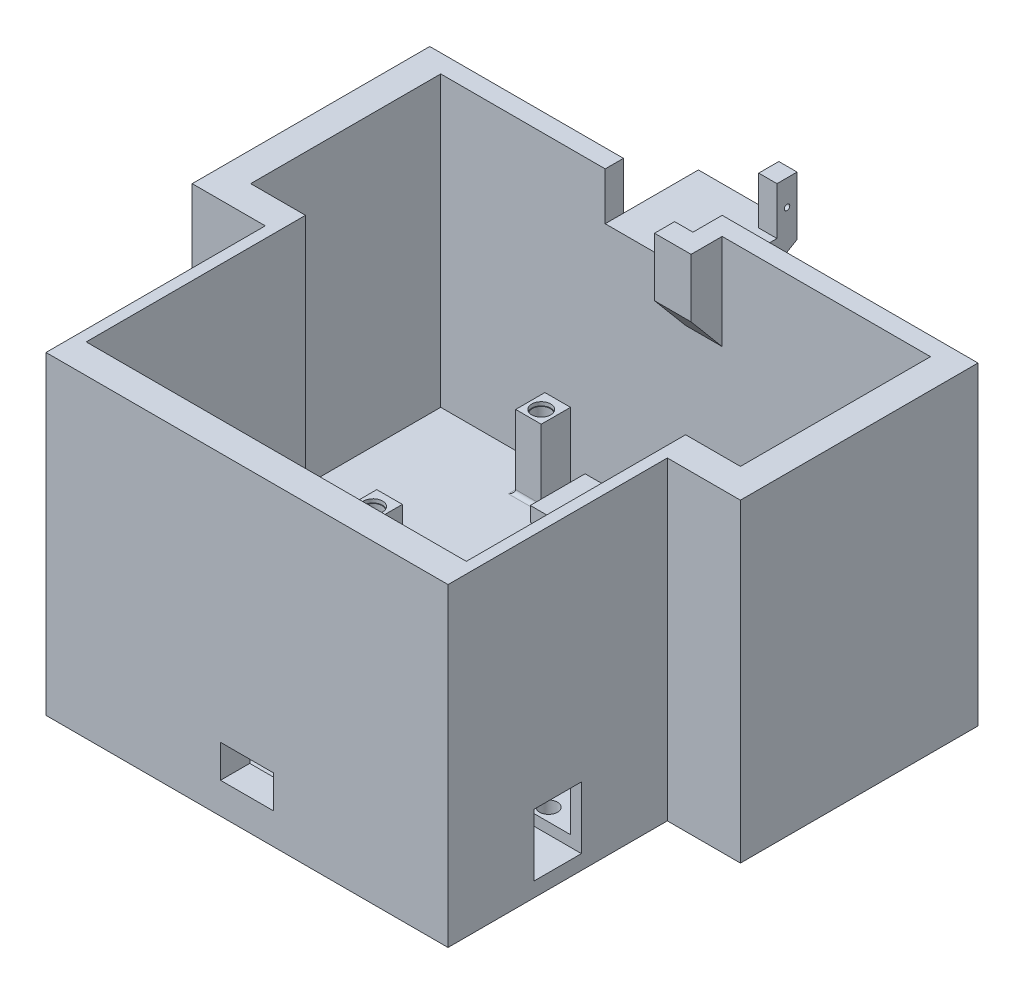
from build123d import *

# Parameters (mm, degrees)
CROQUIS1_W               = 150
CROQUIS1_H               = 150
SALIENTE_EXTRUIR2_DEPTH  = 6
CROQUIS3_W               = 20
CROQUIS3_H               = 60
CORTAR_EXTRUIR2_DEPTH    = 107.235587258
CROQUIS4_W               = 150
CROQUIS4_H               = 25
CORTAR_EXTRUIR3_DEPTH    = 107.235587258
SALIENTE_EXTRUIR3_DEPTH  = 80
CROQUIS6_W               = 16
CROQUIS6_H               = 13
CORTAR_EXTRUIR5_DEPTH    = 80
CROQUIS10_W              = 55
CROQUIS10_H              = 25
CORTAR_EXTRUIR6_DEPTH    = 5
CROQUIS8_W               = 20.5
CROQUIS8_H               = 13
CORTAR_EXTRUIR7_DEPTH    = 2
CROQUIS12_W              = 8
CROQUIS12_H              = 13
CORTAR_EXTRUIR8_DEPTH    = 2
SALIENTE_EXTRUIR6_DEPTH  = 1
CROQUIS17_W              = 8
CROQUIS17_H              = 13
SALIENTE_EXTRUIR7_DEPTH  = 65
CORTAR_EXTRUIR9_REACH    = 171.251
CROQUIS20_W              = 22
CROQUIS20_H              = 13
CROQUIS23_W              = 6
CROQUIS23_H              = 13
CROQUIS23_W_2            = 13
CROQUIS23_H_2            = 6
CORTAR_EXTRUIR10_DEPTH   = 3
CROQUIS24_W              = 22
CROQUIS24_H              = 34
SALIENTE_EXTRUIR9_DEPTH  = 3
SALIENTE_EXTRUIR10_DEPTH = 27
CROQUIS27_W              = 5
CROQUIS27_H              = 5.5
SALIENTE_EXTRUIR14_DEPTH = 13
CORTAR_EXTRUIR11_REACH   = 138.55
CROQUIS30_W              = 45
CROQUIS30_H              = 3
CROQUIS30_W_2            = 62
CROQUIS30_W_3            = 5
CROQUIS30_H_2            = 60
CORTAR_EXTRUIR12_DEPTH   = 27
CROQUIS34_W              = 55
CROQUIS34_H              = 15
SALIENTE_EXTRUIR16_DEPTH = 4
CROQUIS38_W              = 7
CROQUIS38_H              = 8
SALIENTE_EXTRUIR18_DEPTH = 20
CROQUIS39_R              = 2.6
CORTAR_EXTRUIR13_DEPTH   = 1
CROQUIS40_R              = 2.425
CORTAR_EXTRUIR14_DEPTH   = 22
CROQUIS42_R              = 0.75
CORTAR_EXTRUIR15_DEPTH   = 7.5
CROQUIS44_W              = 14.5
CROQUIS44_H              = 9
CORTAR_EXTRUIR17_DEPTH   = 8
REDONDEO2_R              = 1
REDONDEO3_R              = 1
CROQUIS48_R              = 2.6
CORTAR_EXTRUIR19_DEPTH   = 1
CROQUIS49_R              = 2.425
CORTAR_EXTRUIR20_DEPTH   = 131.483715459
CROQUIS50_R              = 2.425
CORTAR_EXTRUIR21_DEPTH   = 133.253544376
CROQUIS51_R              = 2.6
CORTAR_EXTRUIR22_DEPTH   = 1
CROQUIS56_W              = 5
CROQUIS56_H              = 8
CORTAR_EXTRUIR24_DEPTH   = 13
SALIENTE_EXTRUIR20_DEPTH = 5
CROQUIS60_W              = 5
CROQUIS60_H              = 3
SALIENTE_EXTRUIR21_DEPTH = 13
CROQUIS61_W              = 22
CROQUIS61_H              = 8.5
CORTAR_EXTRUIR25_DEPTH   = 15
SALIENTE_EXTRUIR22_DEPTH = 1


with BuildPart() as part:
    # Croquis1 → Saliente-Extruir2 (new body)
    with BuildSketch(Plane(origin=(0, 0, 0), x_dir=(1, 0, 0), z_dir=(0, 1, 0))):
        Rectangle(CROQUIS1_W, CROQUIS1_H)
    extrude(amount=SALIENTE_EXTRUIR2_DEPTH)

    # Croquis3 → Cortar-Extruir2 (cut, through all)
    with BuildSketch(Plane(origin=(0, 6, 0), x_dir=(1, 0, 0), z_dir=(0, 1, 0))):
        with Locations((-65, -45)):
            Rectangle(CROQUIS3_W, CROQUIS3_H)
        with Locations((65, -45)):
            Rectangle(CROQUIS3_W, CROQUIS3_H)
    extrude(amount=-CORTAR_EXTRUIR2_DEPTH, mode=Mode.SUBTRACT)

    # Croquis4 → Cortar-Extruir3 (cut, through all)
    with BuildSketch(Plane(origin=(0, 6, 0), x_dir=(1, 0, 0), z_dir=(0, 1, 0))):
        with Locations((0, 62.5)):
            Rectangle(CROQUIS4_W, CROQUIS4_H)
    extrude(amount=-CORTAR_EXTRUIR3_DEPTH, mode=Mode.SUBTRACT)

    # Croquis5 → Saliente-Extruir3 (add)
    with BuildSketch(Plane(origin=(0, 6, 0), x_dir=(1, 0, 0), z_dir=(0, 1, 0))):
        Polygon((75, -15), (75, 50), (-75, 50), (-75, -15), (-55, -15), (-55, -75), (55, -75), (55, -15), align=None)
        Polygon((67, -7), (67, 42), (-67, 42), (-67, -7), (-47, -7), (-47, -67), (47, -67), (47, -7), align=None, mode=Mode.SUBTRACT)
    extrude(amount=SALIENTE_EXTRUIR3_DEPTH)

    # Croquis6 → Cortar-Extruir5 (cut)
    with BuildSketch(Plane(origin=(0, 86, 0), x_dir=(1, 0, 0), z_dir=(0, 1, 0))):
        with Locations((-55, -45)):
            Rectangle(CROQUIS6_W, CROQUIS6_H)
        with Locations((55, -45)):
            Rectangle(CROQUIS6_W, CROQUIS6_H)
    extrude(amount=-CORTAR_EXTRUIR5_DEPTH, mode=Mode.SUBTRACT)

    # Croquis10 → Cortar-Extruir6 (cut)
    with BuildSketch(Plane.XZ):
        with Locations((0, -37.5)):
            Rectangle(CROQUIS10_W, CROQUIS10_H)
    extrude(amount=-CORTAR_EXTRUIR6_DEPTH, mode=Mode.SUBTRACT)

    # Croquis8 → Cortar-Extruir7 (cut)
    with BuildSketch(Plane(origin=(0, 6, 0), x_dir=(1, 0, 0), z_dir=(0, 1, 0))):
        with Locations((-36.75, -45)):
            Rectangle(CROQUIS8_W, CROQUIS8_H)
        with Locations((36.75, -45)):
            Rectangle(CROQUIS8_W, CROQUIS8_H)
    extrude(amount=-CORTAR_EXTRUIR7_DEPTH, mode=Mode.SUBTRACT)

    # Croquis12 → Cortar-Extruir8 (cut)
    with BuildSketch(Plane(origin=(0, 6, 0), x_dir=(1, 0, 0), z_dir=(0, 1, 0))):
        with Locations((-51, -45)):
            Rectangle(CROQUIS12_W, CROQUIS12_H)
        with Locations((51, -45)):
            Rectangle(CROQUIS12_W, CROQUIS12_H)
    extrude(amount=-CORTAR_EXTRUIR8_DEPTH, mode=Mode.SUBTRACT)

    # Croquis15 → Saliente-Extruir6 (add)
    with BuildSketch(Plane(origin=(0, 6, 0), x_dir=(1, 0, 0), z_dir=(0, 1, 0))):
        Polygon((-47, -7), (-47, -38.5), (-26.5, -38.5), (-26.5, -51.5), (-47, -51.5), (-47, -67), (47, -67), (47, -51.5), (26.5, -51.5), (26.5, -38.5), (47, -38.5), (47, -7), (67, -7), (67, 42), (-67, 42), (-67, -7), align=None)
    extrude(amount=SALIENTE_EXTRUIR6_DEPTH)

    # Croquis17 → Saliente-Extruir7 (add)
    with BuildSketch(Plane(origin=(0, 86, 0), x_dir=(1, 0, 0), z_dir=(0, 1, 0))):
        with Locations((-51, -45)):
            Rectangle(CROQUIS17_W, CROQUIS17_H)
        with Locations((51, -45)):
            Rectangle(CROQUIS17_W, CROQUIS17_H)
    extrude(amount=-SALIENTE_EXTRUIR7_DEPTH)

    # Croquis20 → Cortar-Extruir9 (cut, up to next)
    with BuildSketch(Plane(origin=(0, 0, -50), x_dir=(-1, 0, 0), z_dir=(0, 0, -1)), mode=Mode.PRIVATE) as cortar_extruir9_sk1:
        with Locations((11, 79.5)):
            Rectangle(CROQUIS20_W, CROQUIS20_H)
    cortar_extruir9_tool1 = extrude(cortar_extruir9_sk1.sketch, amount=-CORTAR_EXTRUIR9_REACH, mode=Mode.PRIVATE) & part.part
    add(cortar_extruir9_tool1.solids().sort_by_distance((-11, 79.5, -50))[0], mode=Mode.SUBTRACT)

    # Croquis23 → Cortar-Extruir10 (cut)
    with BuildSketch(Plane(origin=(0, 86, 0), x_dir=(1, 0, 0), z_dir=(0, 1, 0))):
        with Locations((-71, 17.5)):
            Rectangle(CROQUIS23_W, CROQUIS23_H)
        with Locations((71, 17.5)):
            Rectangle(CROQUIS23_W, CROQUIS23_H)
        with Locations((0, -71)):
            Rectangle(CROQUIS23_W_2, CROQUIS23_H_2)
    extrude(amount=-CORTAR_EXTRUIR10_DEPTH, mode=Mode.SUBTRACT)

    # Croquis24 → Saliente-Extruir9 (add)
    with BuildSketch(Plane(origin=(0, 73, 0), x_dir=(1, 0, 0), z_dir=(0, 1, 0))):
        with Locations((-11, 53.5)):
            Rectangle(CROQUIS24_W, CROQUIS24_H)
    extrude(amount=-SALIENTE_EXTRUIR9_DEPTH)

    # Croquis25 → Saliente-Extruir10 (add)
    with BuildSketch(Plane.ZY.offset(22)):
        Polygon((-36.5, 73), (-36.5, 70), (-46.454041192, 58.164319482), (-46.454041192, 73), align=None)
        Polygon((-50, 73), (-70.5, 73), (-70.5, 70), (-50, 58.164319482), align=None)
    extrude(amount=-SALIENTE_EXTRUIR10_DEPTH)

    # Croquis27 → Saliente-Extruir14 (add)
    with BuildSketch(Plane(origin=(0, 73, 0), x_dir=(1, 0, 0), z_dir=(0, 1, 0))):
        with Locations((2.5, 67.75)):
            Rectangle(CROQUIS27_W, CROQUIS27_H)
        with Locations((2.5, 39.25)):
            Rectangle(CROQUIS27_W, CROQUIS27_H)
    extrude(amount=SALIENTE_EXTRUIR14_DEPTH)

    # Cortar-Extruir11: up to this face of the body (flat: up to its plane)
    cortar_extruir11_end = Plane(part.part.faces().sort_by_distance((0, 7, 5.97875439))[0])
    # Croquis30 → Cortar-Extruir11 (cut, up to the picked face)
    with BuildSketch(Plane(origin=(0, 86, 0), x_dir=(1, 0, 0), z_dir=(0, 1, 0)), mode=Mode.PRIVATE) as cortar_extruir11_sk1:
        with Locations((-44.5, 43.5)):
            Rectangle(CROQUIS30_W, CROQUIS30_H)
    cortar_extruir11_tool1 = split(extrude(cortar_extruir11_sk1.sketch, amount=-CORTAR_EXTRUIR11_REACH, mode=Mode.PRIVATE), bisect_by=cortar_extruir11_end, keep=Keep.BOTH, mode=Mode.PRIVATE)
    # Croquis30 → Cortar-Extruir11 (cut, up to the picked face)
    with BuildSketch(Plane(origin=(0, 86, 0), x_dir=(1, 0, 0), z_dir=(0, 1, 0)), mode=Mode.PRIVATE) as cortar_extruir11_sk2:
        with Locations((36, 43.5)):
            Rectangle(CROQUIS30_W_2, CROQUIS30_H)
    cortar_extruir11_tool2 = split(extrude(cortar_extruir11_sk2.sketch, amount=-CORTAR_EXTRUIR11_REACH, mode=Mode.PRIVATE), bisect_by=cortar_extruir11_end, keep=Keep.BOTH, mode=Mode.PRIVATE)
    # Croquis30 → Cortar-Extruir11 (cut, up to the picked face)
    with BuildSketch(Plane(origin=(0, 86, 0), x_dir=(1, 0, 0), z_dir=(0, 1, 0)), mode=Mode.PRIVATE) as cortar_extruir11_sk3:
        with Locations((-49.5, -37)):
            Rectangle(CROQUIS30_W_3, CROQUIS30_H_2)
    cortar_extruir11_tool3 = split(extrude(cortar_extruir11_sk3.sketch, amount=-CORTAR_EXTRUIR11_REACH, mode=Mode.PRIVATE), bisect_by=cortar_extruir11_end, keep=Keep.BOTH, mode=Mode.PRIVATE)
    # Croquis30 → Cortar-Extruir11 (cut, up to the picked face)
    with BuildSketch(Plane(origin=(0, 86, 0), x_dir=(1, 0, 0), z_dir=(0, 1, 0)), mode=Mode.PRIVATE) as cortar_extruir11_sk4:
        with Locations((49.5, -37)):
            Rectangle(CROQUIS30_W_3, CROQUIS30_H_2)
    cortar_extruir11_tool4 = split(extrude(cortar_extruir11_sk4.sketch, amount=-CORTAR_EXTRUIR11_REACH, mode=Mode.PRIVATE), bisect_by=cortar_extruir11_end, keep=Keep.BOTH, mode=Mode.PRIVATE)
    add(cortar_extruir11_tool1.solids().sort_by(Axis((-44.5, 86, -43.5), (0, -1, 0)))[0], mode=Mode.SUBTRACT)
    add(cortar_extruir11_tool2.solids().sort_by(Axis((36, 86, -43.5), (0, -1, 0)))[0], mode=Mode.SUBTRACT)
    add(cortar_extruir11_tool3.solids().sort_by(Axis((-49.5, 86, 37), (0, -1, 0)))[0], mode=Mode.SUBTRACT)
    add(cortar_extruir11_tool4.solids().sort_by(Axis((49.5, 86, 37), (0, -1, 0)))[0], mode=Mode.SUBTRACT)

    # Croquis31 → Cortar-Extruir12 (cut)
    with BuildSketch(Plane(origin=(5, 0, 0), x_dir=(0, 0, -1), z_dir=(1, 0, 0))):
        Polygon((42, 63.460320126), (42, 7), (45, 7), (45, 59.893222012), align=None)
    extrude(amount=-CORTAR_EXTRUIR12_DEPTH, mode=Mode.SUBTRACT)

    # Croquis34 → Saliente-Extruir16 (add)
    with BuildSketch(Plane(origin=(0, 7, 0), x_dir=(1, 0, 0), z_dir=(0, 1, 0))):
        with Locations((0, 37.5)):
            Rectangle(CROQUIS34_W, CROQUIS34_H)
    extrude(amount=SALIENTE_EXTRUIR16_DEPTH)

    # Croquis38 → Saliente-Extruir18 (add)
    with BuildSketch(Plane(origin=(0, 7, 0), x_dir=(1, 0, 0), z_dir=(0, 1, 0))):
        with Locations((-32.75, 38.75)):
            Rectangle(CROQUIS38_W, CROQUIS38_H)
        with Locations((32.75, 38.75)):
            Rectangle(CROQUIS38_W, CROQUIS38_H)
        with Locations((32.75, -7.25)):
            Rectangle(CROQUIS38_W, CROQUIS38_H)
        with Locations((-32.75, -7.25)):
            Rectangle(CROQUIS38_W, CROQUIS38_H)
        with Locations((19, -22.25)):
            Rectangle(CROQUIS38_W, CROQUIS38_H)
        with Locations((-19, -22.25)):
            Rectangle(CROQUIS38_W, CROQUIS38_H)
        with Locations((19, -60.25)):
            Rectangle(CROQUIS38_W, CROQUIS38_H)
        with Locations((-19, -60.25)):
            Rectangle(CROQUIS38_W, CROQUIS38_H)
    extrude(amount=SALIENTE_EXTRUIR18_DEPTH)

    # Croquis39 → Cortar-Extruir13 (cut)
    with BuildSketch(Plane(origin=(0, 27, 0), x_dir=(1, 0, 0), z_dir=(0, 1, 0))):
        with Locations(Location((-32.75, 38.25, 0), (0, 0, 270))):
            Circle(CROQUIS39_R)
        with Locations(Location((32.75, 38.25, 0), (0, 0, 90))):
            Circle(CROQUIS39_R)
        with Locations(Location((32.75, -7.75, 0), (0, 0, 270))):
            Circle(CROQUIS39_R)
        with Locations(Location((-32.75, -7.75, 0), (0, 0, 90))):
            Circle(CROQUIS39_R)
        with Locations(Location((-19, -22.25, 0), (0, 0, 270))):
            Circle(CROQUIS39_R)
        with Locations(Location((19, -22.25, 0), (0, 0, 90))):
            Circle(CROQUIS39_R)
        with Locations(Location((19, -60.25, 0), (0, 0, 270))):
            Circle(CROQUIS39_R)
        with Locations(Location((-19, -60.25, 0), (0, 0, 90))):
            Circle(CROQUIS39_R)
    extrude(amount=-CORTAR_EXTRUIR13_DEPTH, mode=Mode.SUBTRACT)

    # Croquis40 → Cortar-Extruir14 (cut)
    with BuildSketch(Plane(origin=(0, 26, 0), x_dir=(1, 0, 0), z_dir=(0, 1, 0))):
        with Locations(Location((-32.75, 38.25, 0), (0, 0, 270))):
            Circle(CROQUIS40_R)
        with Locations(Location((32.75, 38.25, 0), (0, 0, 90))):
            Circle(CROQUIS40_R)
        with Locations(Location((32.75, -7.75, 0), (0, 0, 270))):
            Circle(CROQUIS40_R)
        with Locations(Location((-32.75, -7.75, 0), (0, 0, 90))):
            Circle(CROQUIS40_R)
        with Locations(Location((-19, -22.25, 0), (0, 0, 270))):
            Circle(CROQUIS40_R)
        with Locations(Location((19, -22.25, 0), (0, 0, 90))):
            Circle(CROQUIS40_R)
        with Locations(Location((19, -60.25, 0), (0, 0, 270))):
            Circle(CROQUIS40_R)
        with Locations(Location((-19, -60.25, 0), (0, 0, 90))):
            Circle(CROQUIS40_R)
    extrude(amount=-CORTAR_EXTRUIR14_DEPTH, mode=Mode.SUBTRACT)

    # Croquis42 → Cortar-Extruir15 (cut, symmetric)
    with BuildSketch(Plane(origin=(5, 0, 0), x_dir=(0, 0, -1), z_dir=(1, 0, 0))):
        with Locations((67.75, 79)):
            Circle(CROQUIS42_R)
        with Locations((40.25, 79)):
            Circle(CROQUIS42_R)
    extrude(amount=CORTAR_EXTRUIR15_DEPTH, both=True, mode=Mode.SUBTRACT)

    # Croquis44 → Cortar-Extruir17 (cut)
    with BuildSketch(Plane.XY.offset(75)):
        with Locations((0, 13)):
            Rectangle(CROQUIS44_W, CROQUIS44_H)
    extrude(amount=-CORTAR_EXTRUIR17_DEPTH, mode=Mode.SUBTRACT)

    # Redondeo2
    redondeo2_edges = [part.edges().sort_by_distance(p)[0] for p in [
        (-36.25, 7, -38.75),
        (-32.75, 7, -34.75),
        (-29.25, 7, -38.75),
        (-32.75, 7, -42.75),
    ]]
    fillet(redondeo2_edges, radius=REDONDEO2_R)

    # Redondeo3
    redondeo3_edges = [part.edges().sort_by_distance(p)[0] for p in [
        (29.25, 7, -38.75),
        (32.75, 7, -34.75),
        (36.25, 7, -38.75),
        (32.75, 7, -42.75),
        (32.75, 7, 3.25),
        (29.25, 7, 7.25),
        (32.75, 7, 11.25),
        (36.25, 7, 7.25),
        (-29.25, 7, 7.25),
        (-32.75, 7, 3.25),
        (-36.25, 7, 7.25),
        (-32.75, 7, 11.25),
        (-22.5, 7, 22.25),
        (-19, 7, 26.25),
        (-15.5, 7, 22.25),
        (-19, 7, 18.25),
        (15.5, 7, 22.25),
        (19, 7, 26.25),
        (22.5, 7, 22.25),
        (19, 7, 18.25),
        (19, 7, 56.25),
        (15.5, 7, 60.25),
        (19, 7, 64.25),
        (22.5, 7, 60.25),
        (-15.5, 7, 60.25),
        (-19, 7, 56.25),
        (-22.5, 7, 60.25),
        (-19, 7, 64.25),
    ]]
    fillet(redondeo3_edges, radius=REDONDEO3_R)

    # Croquis48 → Cortar-Extruir19 (cut)
    with BuildSketch(Plane(origin=(0, 11, 0), x_dir=(1, 0, 0), z_dir=(0, 1, 0))):
        with Locations(Location((20, 37.5, 0), (0, 0, 270))):
            Circle(CROQUIS48_R)
    cortar_extruir19 = extrude(amount=-CORTAR_EXTRUIR19_DEPTH, mode=Mode.SUBTRACT)

    # Simetría6: Cortar-Extruir19 across plane
    add(cortar_extruir19.mirror(Plane(origin=(0, 0, 0), x_dir=(0, 0, 1), z_dir=(1, 0, 0))), mode=Mode.SUBTRACT)

    # Croquis49 → Cortar-Extruir20 (cut, through all)
    with BuildSketch(Plane(origin=(0, 10, 0), x_dir=(1, 0, 0), z_dir=(0, 1, 0))):
        with Locations(Location((20, 37.5, 0), (0, 0, 270))):
            Circle(CROQUIS49_R)
    cortar_extruir20 = extrude(amount=-CORTAR_EXTRUIR20_DEPTH, mode=Mode.SUBTRACT)

    # Simetría7: Cortar-Extruir20 across plane
    add(cortar_extruir20.mirror(Plane(origin=(0, 0, 0), x_dir=(0, 0, 1), z_dir=(1, 0, 0))), mode=Mode.SUBTRACT)

    # Croquis50 → Cortar-Extruir21 (cut, through all)
    with BuildSketch(Plane(origin=(0, 7, 0), x_dir=(1, 0, 0), z_dir=(0, 1, 0))):
        with Locations(Location((-42.5, -35, 0), (0, 0, 270))):
            Circle(CROQUIS50_R)
        with Locations(Location((-42.5, -55, 0), (0, 0, 90))):
            Circle(CROQUIS50_R)
        with Locations(Location((42.5, -55, 0), (0, 0, 270))):
            Circle(CROQUIS50_R)
        with Locations(Location((42.5, -35, 0), (0, 0, 90))):
            Circle(CROQUIS50_R)
    extrude(amount=-CORTAR_EXTRUIR21_DEPTH, mode=Mode.SUBTRACT)

    # Croquis51 → Cortar-Extruir22 (cut)
    with BuildSketch(Plane.XZ):
        with Locations(Location((-42.5, 55, 0), (0, 0, 270))):
            Circle(CROQUIS51_R)
        with Locations(Location((-42.5, 35, 0), (0, 0, 90))):
            Circle(CROQUIS51_R)
        with Locations(Location((42.5, 35, 0), (0, 0, 270))):
            Circle(CROQUIS51_R)
        with Locations(Location((42.5, 55, 0), (0, 0, 90))):
            Circle(CROQUIS51_R)
    extrude(amount=-CORTAR_EXTRUIR22_DEPTH, mode=Mode.SUBTRACT)

    # Croquis56 → Cortar-Extruir24 (cut)
    with BuildSketch(Plane(origin=(0, 86, 0), x_dir=(1, 0, 0), z_dir=(0, 1, 0))):
        with Locations((2.5, 46)):
            Rectangle(CROQUIS56_W, CROQUIS56_H)
    extrude(amount=-CORTAR_EXTRUIR24_DEPTH, mode=Mode.SUBTRACT)

    # Croquis59 → Saliente-Extruir20 (add)
    with BuildSketch(Plane(origin=(5, 0, 0), x_dir=(0, 0, -1), z_dir=(1, 0, 0))):
        Polygon((45, 73), (42, 73), (42, 86), (36.5, 86), (36.5, 70), (45, 59.893222012), align=None)
    extrude(amount=SALIENTE_EXTRUIR20_DEPTH)

    # Croquis60 → Saliente-Extruir21 (add)
    with BuildSketch(Plane(origin=(0, 86, 0), x_dir=(1, 0, 0), z_dir=(0, 1, 0))):
        with Locations((7.5, 43.5)):
            Rectangle(CROQUIS60_W, CROQUIS60_H)
    extrude(amount=-SALIENTE_EXTRUIR21_DEPTH)

    # Croquis61 → Cortar-Extruir25 (cut)
    with BuildSketch(Plane(origin=(0, 73, 0), x_dir=(1, 0, 0), z_dir=(0, 1, 0))):
        with Locations((-11, 40.75)):
            Rectangle(CROQUIS61_W, CROQUIS61_H)
    extrude(amount=-CORTAR_EXTRUIR25_DEPTH, mode=Mode.SUBTRACT)

    # Croquis62 → Saliente-Extruir22 (add)
    with BuildSketch(Plane(origin=(0, 86, 0), x_dir=(1, 0, 0), z_dir=(0, 1, 0))):
        Polygon((5, 50), (5, 42), (0, 42), (0, 36.5), (10, 36.5), (10, 45), (67, 45), (67, -7), (52, -7), (52, -67), (-52, -67), (-52, -7), (-67, -7), (-67, 45), (-22, 45), (-22, 50), (-75, 50), (-75, -15), (-55, -15), (-55, -75), (55, -75), (55, -15), (75, -15), (75, 50), align=None)
    extrude(amount=-SALIENTE_EXTRUIR22_DEPTH)


solid = part.part
